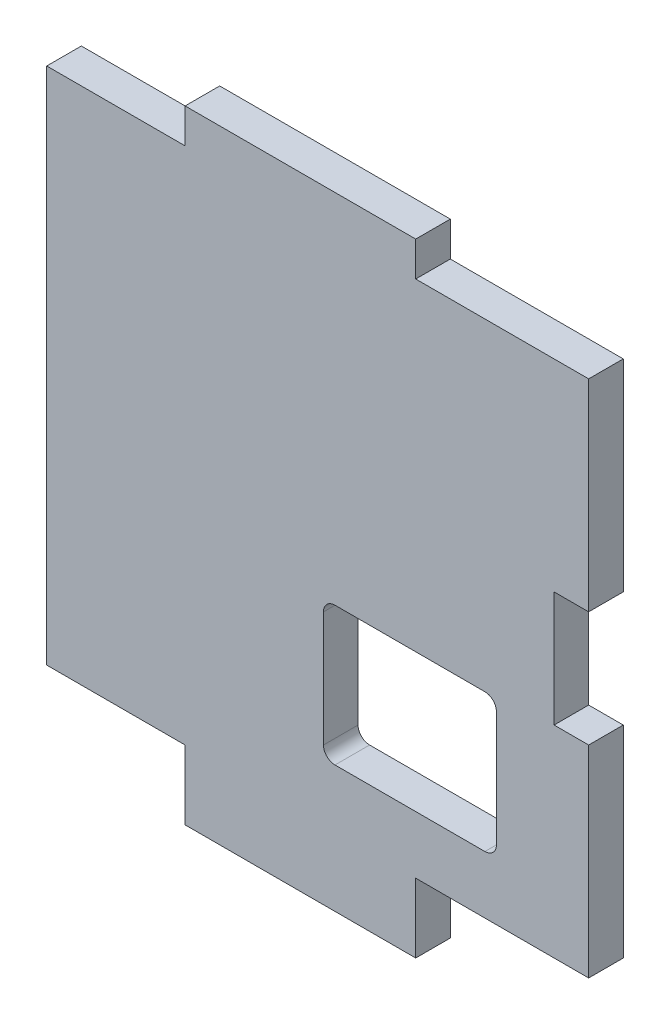
from build123d import *

# Parameters (mm, degrees)
BOSS_EXTRUDE1_DEPTH = 3
SKETCH2_W           = 15
SKETCH2_H           = 12
CUT_EXTRUDE1_DEPTH  = 68.245817714
FILLET1_R           = 1


with BuildPart() as part:
    # Sketch1 → Boss-Extrude1 (new body)
    with BuildSketch(Plane.XY):
        Polygon((0, 0), (0, 45), (12, 45), (12, 48), (32, 48), (32, 45), (47, 45), (47, 27.5), (44, 27.5), (44, 17.5), (47, 17.5), (47, 0), (32, 0), (32, -6), (12, -6), (12, 0), align=None)
    extrude(amount=BOSS_EXTRUDE1_DEPTH)

    # Sketch2 → Cut-Extrude1 (cut, through all)
    with BuildSketch(Plane.XY.offset(3)):
        with Locations((31.5, 11)):
            Rectangle(SKETCH2_W, SKETCH2_H)
    extrude(amount=-CUT_EXTRUDE1_DEPTH, mode=Mode.SUBTRACT)

    # Fillet1
    fillet1_edges = [part.edges().sort_by_distance(p)[0] for p in [
        (24, 5, 1.5),
        (24, 17, 1.5),
        (39, 17, 1.5),
        (39, 5, 1.5),
    ]]
    fillet(fillet1_edges, radius=FILLET1_R)


solid = part.part
